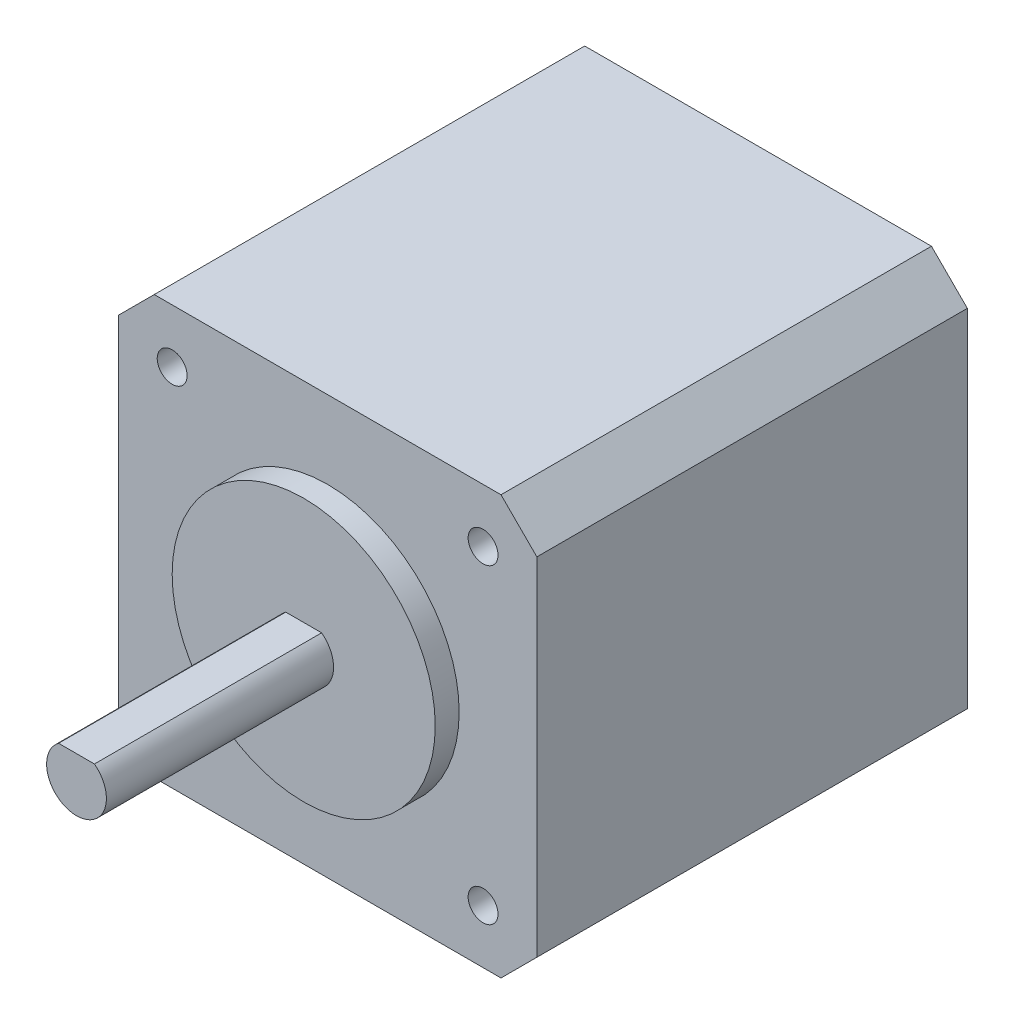
from build123d import *

# Parameters (mm, degrees)
BOSS_EXTRUDE1_DEPTH       = 36
SKETCH1_3_R               = 11
BOSS_EXTRUDE2_DEPTH       = 2
M3X0_5_TAPPED_HOLE1_D     = 2.5
M3X0_5_TAPPED_HOLE1_DEPTH = 5
M3X0_5_TAPPED_HOLE1_TIP   = 0.751075774
BOSS_EXTRUDE3_DEPTH       = 21


with BuildPart() as part:
    # Sketch1 → Boss-Extrude1 (new body)
    with BuildSketch(Plane.XY):
        Polygon((-14.5, 17.5), (-17.5, 14.5), (-17.5, -14.5), (-14.5, -17.5), (14.5, -17.5), (17.5, -14.5), (17.5, 14.5), (14.5, 17.5), align=None)
    extrude(amount=-BOSS_EXTRUDE1_DEPTH)

    # Sketch1<3> → Boss-Extrude2 (add)
    with BuildSketch(Plane.XY):
        Circle(SKETCH1_3_R)
    extrude(amount=BOSS_EXTRUDE2_DEPTH)

    # M3x0.5 Tapped Hole1
    with Locations(Plane.XY):
        with Locations((13, 13), (-13, 13), (-13, -13), (13, -13)):
            Hole(M3X0_5_TAPPED_HOLE1_D / 2, depth=M3X0_5_TAPPED_HOLE1_DEPTH)
            with Locations((0, 0, -(M3X0_5_TAPPED_HOLE1_DEPTH + M3X0_5_TAPPED_HOLE1_TIP / 2))):  # 118° drill point
                Cone(0, M3X0_5_TAPPED_HOLE1_D / 2, M3X0_5_TAPPED_HOLE1_TIP, mode=Mode.SUBTRACT)

    # Sketch1<4> → Boss-Extrude3 (add)
    with BuildSketch(Plane.XY):
        with BuildLine():
            Line((1.5, 2), (-1.5, 2))
            ThreePointArc((-1.5, 2), (0, -2.5), (1.5, 2))
        make_face()
    extrude(amount=BOSS_EXTRUDE3_DEPTH)


solid = part.part
